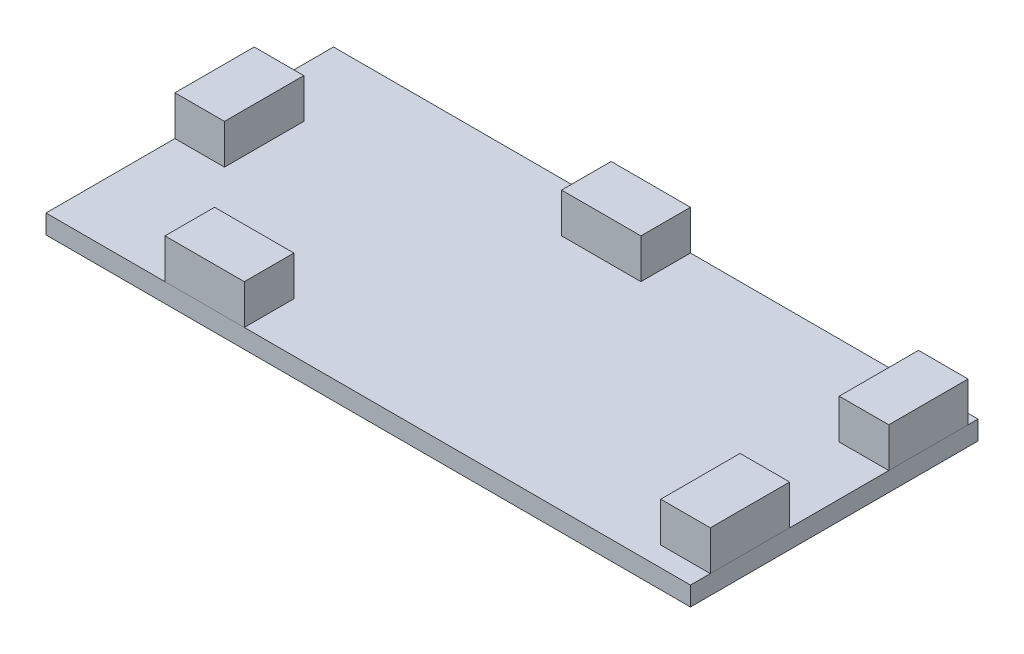
from build123d import *

# Parameters (mm, degrees)
SKETCH1_W             = 51.59375
SKETCH1_H             = 23.01875
BOSS_EXTRUDE1_DEPTH   = 1.524
SKETCH2_W             = 3.96875
SKETCH2_H             = 6.35
BOSS_EXTRUDE2_DEPTH   = 3.175
BOSS_EXTRUDE2_2_DEPTH = 3.175
SKETCH2_W_2           = 6.35
SKETCH2_H_2           = 3.96875
BOSS_EXTRUDE2_3_DEPTH = 3.175
BOSS_EXTRUDE2_4_DEPTH = 3.175
BOSS_EXTRUDE2_5_DEPTH = 3.175


with BuildPart() as part:
    # Sketch1 → Boss-Extrude1 (new body)
    with BuildSketch(Plane(origin=(0, 0, 0), x_dir=(1, 0, 0), z_dir=(0, 1, 0))):
        Rectangle(SKETCH1_W, SKETCH1_H)
    extrude(amount=BOSS_EXTRUDE1_DEPTH)


with BuildPart() as body_2:
    # Sketch2 → Boss-Extrude2 (new body)
    with BuildSketch(Plane(origin=(0, 1.524, 0), x_dir=(1, 0, 0), z_dir=(0, 1, 0))):
        with Locations((23.8125, -6.746875)):
            Rectangle(SKETCH2_W, SKETCH2_H)
    extrude(amount=BOSS_EXTRUDE2_DEPTH)


with BuildPart() as body_3:
    # Sketch2 → Boss-Extrude2 2 (new body)
    with BuildSketch(Plane(origin=(0, 1.524, 0), x_dir=(1, 0, 0), z_dir=(0, 1, 0))):
        with Locations((23.8125, 7.540625)):
            Rectangle(SKETCH2_W, SKETCH2_H)
    extrude(amount=BOSS_EXTRUDE2_2_DEPTH)


with BuildPart() as body_4:
    # Sketch2 → Boss-Extrude2 3 (new body)
    with BuildSketch(Plane(origin=(0, 1.524, 0), x_dir=(1, 0, 0), z_dir=(0, 1, 0))):
        with Locations((-0.396875, 9.525)):
            Rectangle(SKETCH2_W_2, SKETCH2_H_2)
    extrude(amount=BOSS_EXTRUDE2_3_DEPTH)


with BuildPart() as body_5:
    # Sketch2 → Boss-Extrude2 4 (new body)
    with BuildSketch(Plane(origin=(0, 1.524, 0), x_dir=(1, 0, 0), z_dir=(0, 1, 0))):
        with Locations((-23.8125, 1.984375)):
            Rectangle(SKETCH2_W, SKETCH2_H)
    extrude(amount=BOSS_EXTRUDE2_4_DEPTH)


with BuildPart() as body_6:
    # Sketch2 → Boss-Extrude2 5 (new body)
    with BuildSketch(Plane(origin=(0, 1.524, 0), x_dir=(1, 0, 0), z_dir=(0, 1, 0))):
        with Locations((-13.096875, -9.525)):
            Rectangle(SKETCH2_W_2, SKETCH2_H_2)
    extrude(amount=BOSS_EXTRUDE2_5_DEPTH)


solid = Compound([part.part, body_2.part, body_3.part, body_4.part, body_5.part, body_6.part])
